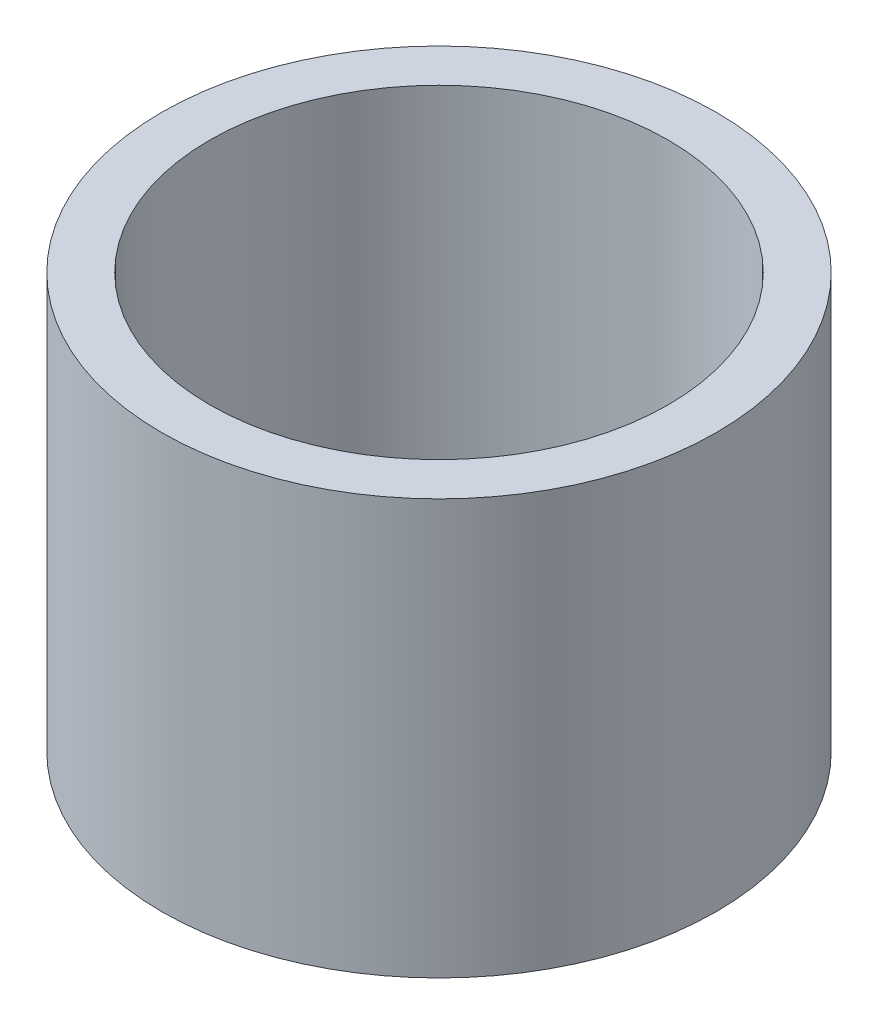
from build123d import *

# Parameters (mm, degrees)
SKETCH_1_R      = 6.35
SKETCH_1_R_2    = 5.25
EXTRUDE_1_DEPTH = 9.5


with BuildPart() as part:
    # Эскиз1 → Бобышка-Вытянуть1 (new body)
    with BuildSketch(Plane(origin=(0, 0, 0), x_dir=(1, 0, 0), z_dir=(0, 1, 0))):
        with Locations(Location((0, 0, 0), (0, 0, 270))):
            Circle(SKETCH_1_R)
        with Locations(Location((0, 0, 0), (0, 0, 270))):
            Circle(SKETCH_1_R_2, mode=Mode.SUBTRACT)
    extrude(amount=EXTRUDE_1_DEPTH)


solid = part.part
